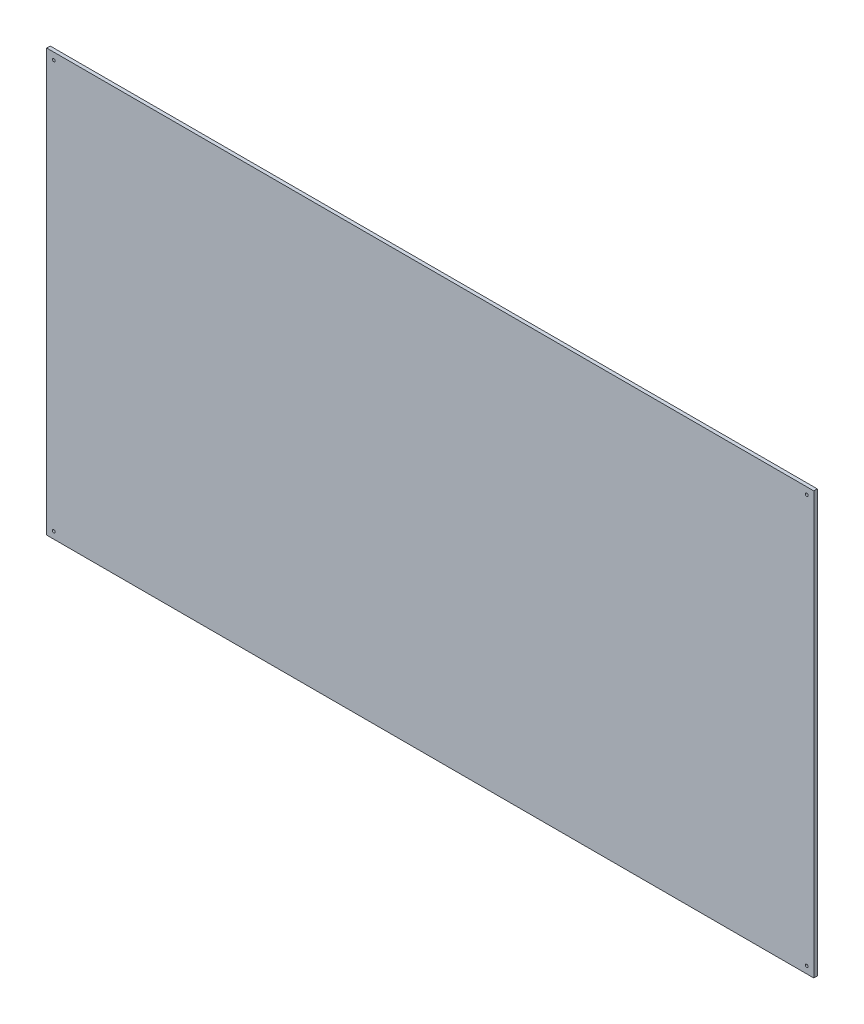
from build123d import *

# Parameters (mm, degrees)
SKETCH_1_W          = 2200
SKETCH_1_H          = 1210
EXTRUDE_1_DEPTH     = 10
SKETCH_2_R          = 4.05
CUT_EXTRUDE_1_DEPTH = 10


with BuildPart() as part:
    # 草图1 → 凸台-拉伸1 (new body)
    with BuildSketch(Plane.XY):
        Rectangle(SKETCH_1_W, SKETCH_1_H)
    extrude(amount=EXTRUDE_1_DEPTH)

    # 草图2 → 切除-拉伸1 (cut)
    with BuildSketch(Plane.XY.offset(10)):
        with Locations((-1080, 585)):
            Circle(SKETCH_2_R)
        with Locations(Location((1080, 585, 0), (0, 0, 180))):
            Circle(SKETCH_2_R)
        with Locations((1080, -585)):
            Circle(SKETCH_2_R)
        with Locations(Location((-1080, -585, 0), (0, 0, 180))):
            Circle(SKETCH_2_R)
    extrude(amount=-CUT_EXTRUDE_1_DEPTH, mode=Mode.SUBTRACT)


solid = part.part
